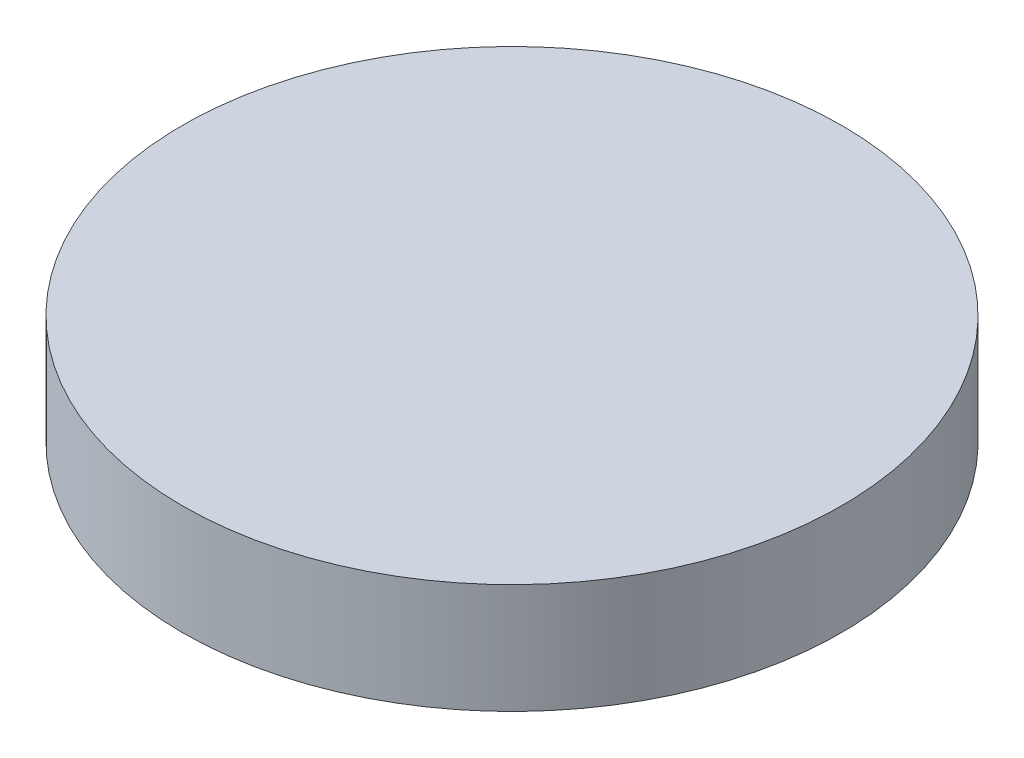
from build123d import *

# Parameters (mm, degrees)
SKETCH1_R           = 4.7625
BOSS_EXTRUDE1_DEPTH = 1.5875


with BuildPart() as part:
    # Sketch1 → Boss-Extrude1 (new body)
    with BuildSketch(Plane(origin=(0, 0, 0), x_dir=(1, 0, 0), z_dir=(0, 1, 0))):
        with Locations(Location((0, 0, 0), (0, 0, 270))):
            Circle(SKETCH1_R)
    extrude(amount=BOSS_EXTRUDE1_DEPTH)


solid = part.part
